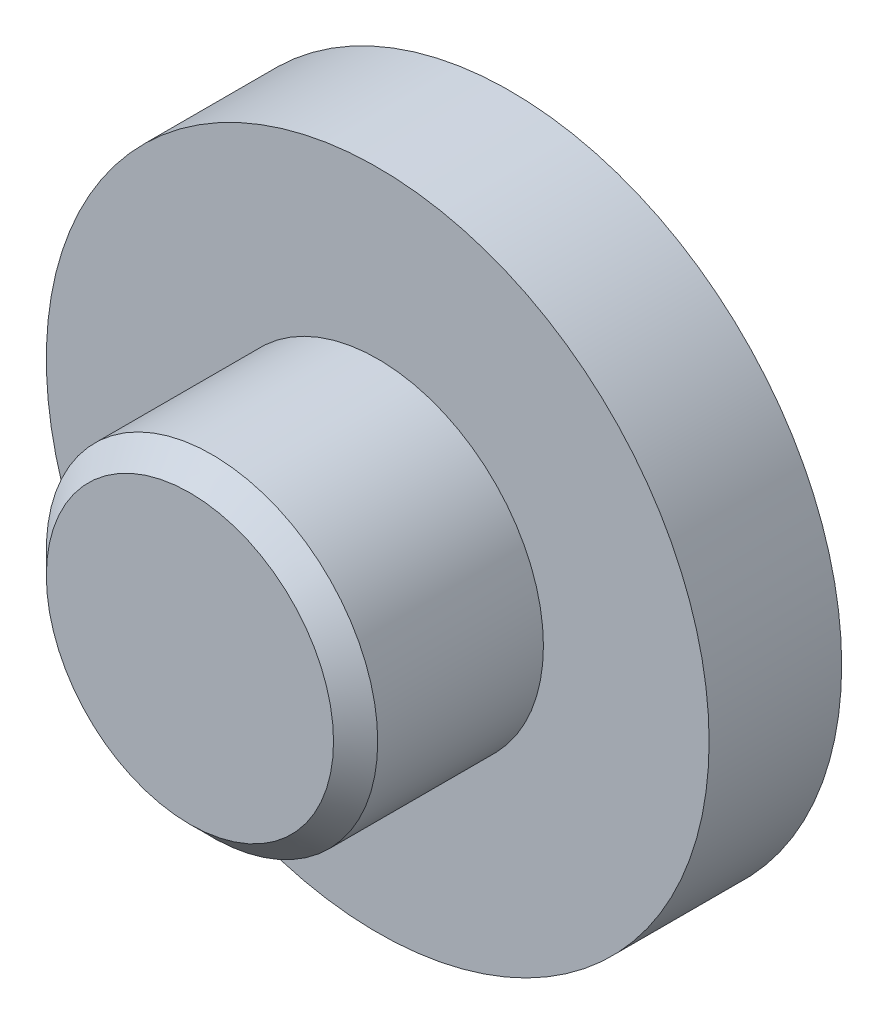
from build123d import *

# Parameters (mm, degrees)
SKETCH1_R           = 30
BOSS_EXTRUDE3_DEPTH = 12
SKETCH3_R           = 15
BOSS_EXTRUDE4_DEPTH = 17
CHAMFER1_SIZE       = 2


with BuildPart() as part:
    # Sketch1 → Boss-Extrude3 (new body)
    with BuildSketch(Plane.XY):
        Circle(SKETCH1_R)
    extrude(amount=BOSS_EXTRUDE3_DEPTH)

    # Sketch3 → Boss-Extrude4 (add)
    with BuildSketch(Plane.XY.offset(12)):
        Circle(SKETCH3_R)
    extrude(amount=BOSS_EXTRUDE4_DEPTH)

    # Chamfer1
    chamfer1_edges = [part.edges().sort_by_distance(p)[0] for p in [
        (-15, 0, 29),
    ]]
    chamfer(chamfer1_edges, length=CHAMFER1_SIZE)


solid = part.part
